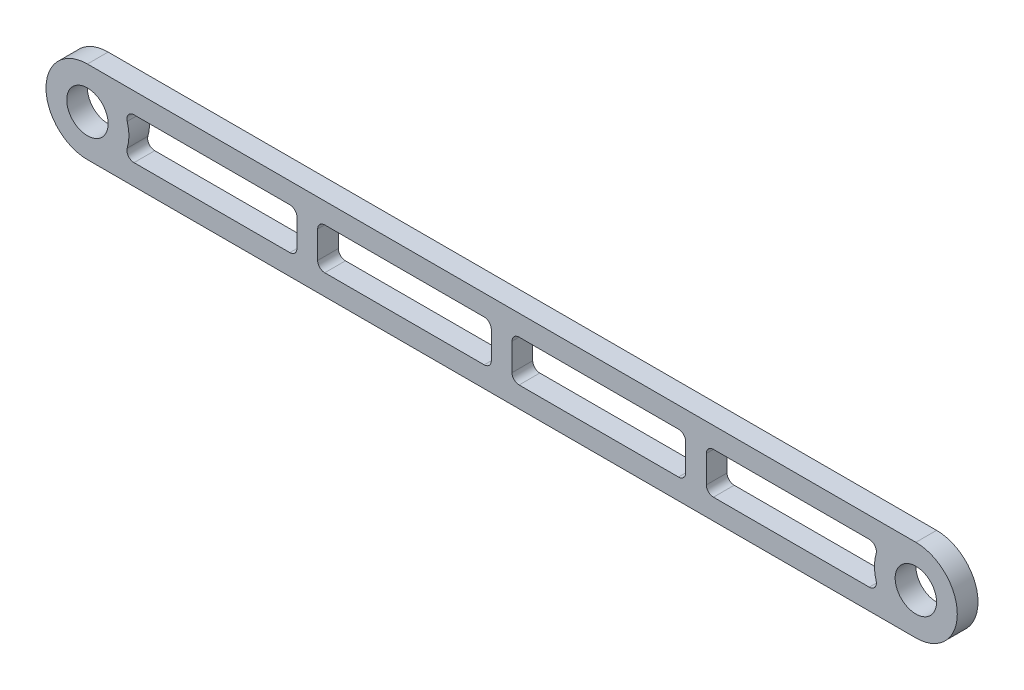
from build123d import *

# Parameters (mm, degrees)
SKETCH_1_R      = 5
EXTRUDE_1_DEPTH = 5


with BuildPart() as part:
    # 草图1 → 凸台-拉伸1 (new body)
    with BuildSketch(Plane.XY):
        with BuildLine():
            Line((0, 10), (200, 10))
            ThreePointArc((200, 10), (210, 0), (200, -10))
            Line((200, -10), (0, -10))
            ThreePointArc((0, -10), (-10, 0), (0, 10))
        make_face()
        Circle(SKETCH_1_R, mode=Mode.SUBTRACT)
        with Locations((200, 0)):
            Circle(SKETCH_1_R, mode=Mode.SUBTRACT)
        with BuildLine():
            Line((11.245449786, 5), (48.864788989, 5))
            ThreePointArc((48.864788989, 5), (50.077716142, 4.497589123), (50.580127019, 3.28466197))
            Line((50.580127019, 3.28466197), (50.580127019, 0))
            Line((50.580127019, 0), (50.580127019, -3.28466197))
            ThreePointArc((50.580127019, -3.28466197), (50.077716142, -4.497589123), (48.864788989, -5))
            Line((48.864788989, -5), (11.245449786, -5))
            ThreePointArc((11.245449786, -5), (9.872979547, -4.313598314), (9.59891192, -2.803727867))
            ThreePointArc((9.59891192, -2.803727867), (10, 0), (9.59891192, 2.803727867))
            ThreePointArc((9.59891192, 2.803727867), (9.872979547, 4.313598314), (11.245449786, 5))
        make_face(mode=Mode.SUBTRACT)
        with BuildLine():
            Line((188.754550214, -5), (151.135211011, -5))
            ThreePointArc((151.135211011, -5), (149.922283858, -4.497589123), (149.419872981, -3.28466197))
            Line((149.419872981, -3.28466197), (149.419872981, 0))
            Line((149.419872981, 0), (149.419872981, 3.28466197))
            ThreePointArc((149.419872981, 3.28466197), (149.922283858, 4.497589123), (151.135211011, 5))
            Line((151.135211011, 5), (188.754550214, 5))
            ThreePointArc((188.754550214, 5), (190.127020453, 4.313598314), (190.40108808, 2.803727867))
            ThreePointArc((190.40108808, 2.803727867), (190, 0), (190.40108808, -2.803727867))
            ThreePointArc((190.40108808, -2.803727867), (190.127020453, -4.313598314), (188.754550214, -5))
        make_face(mode=Mode.SUBTRACT)
        with BuildLine():
            Line((104.21533803, 5), (142.704534951, 5))
            ThreePointArc((142.704534951, 5), (143.917462104, 4.497589123), (144.419872981, 3.28466197))
            Line((144.419872981, 3.28466197), (144.419872981, 0))
            Line((144.419872981, 0), (144.419872981, -3.28466197))
            ThreePointArc((144.419872981, -3.28466197), (143.917462104, -4.497589123), (142.704534951, -5))
            Line((142.704534951, -5), (104.21533803, -5))
            ThreePointArc((104.21533803, -5), (103.002410877, -4.497589123), (102.5, -3.28466197))
            Line((102.5, -3.28466197), (102.5, 0))
            Line((102.5, 0), (102.5, 3.28466197))
            ThreePointArc((102.5, 3.28466197), (103.002410877, 4.497589123), (104.21533803, 5))
        make_face(mode=Mode.SUBTRACT)
        with BuildLine():
            Line((95.78466197, -5), (57.295465049, -5))
            ThreePointArc((57.295465049, -5), (56.082537896, -4.497589123), (55.580127019, -3.28466197))
            Line((55.580127019, -3.28466197), (55.580127019, 0))
            Line((55.580127019, 0), (55.580127019, 3.28466197))
            ThreePointArc((55.580127019, 3.28466197), (56.082537896, 4.497589123), (57.295465049, 5))
            Line((57.295465049, 5), (95.78466197, 5))
            ThreePointArc((95.78466197, 5), (96.997589123, 4.497589123), (97.5, 3.28466197))
            Line((97.5, 3.28466197), (97.5, 0))
            Line((97.5, 0), (97.5, -3.28466197))
            ThreePointArc((97.5, -3.28466197), (96.997589123, -4.497589123), (95.78466197, -5))
        make_face(mode=Mode.SUBTRACT)
    extrude(amount=EXTRUDE_1_DEPTH)


solid = part.part
